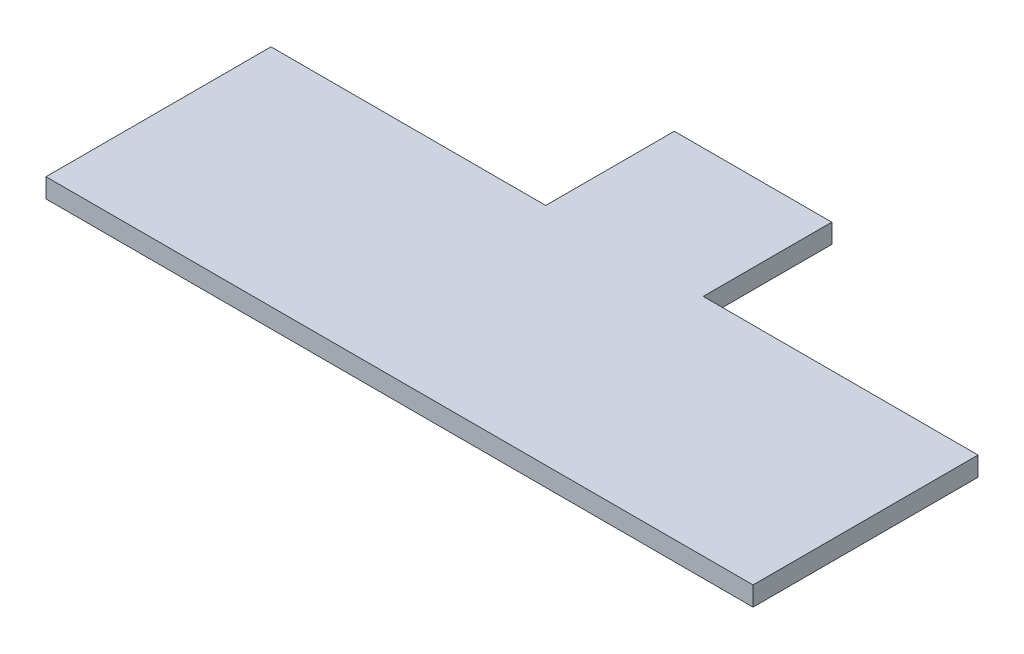
from build123d import *

# Parameters (mm, degrees)
BOSS_EXTRUDE1_DEPTH = 6


with BuildPart() as part:
    # Sketch1 → Boss-Extrude1 (new body)
    with BuildSketch(Plane(origin=(0, 0, 0), x_dir=(1, 0, 0), z_dir=(0, 1, 0))):
        Polygon((-262.905099867, 66.057731185), (-262.905099867, 106.057731185), (-213.905099867, 106.057731185), (-213.905099867, 66.057731185), (-128.405099867, 66.057731185), (-128.405099867, -3.942268815), (-348.405099867, -3.942268815), (-348.405099867, 66.057731185), align=None)
    extrude(amount=BOSS_EXTRUDE1_DEPTH)


solid = part.part
